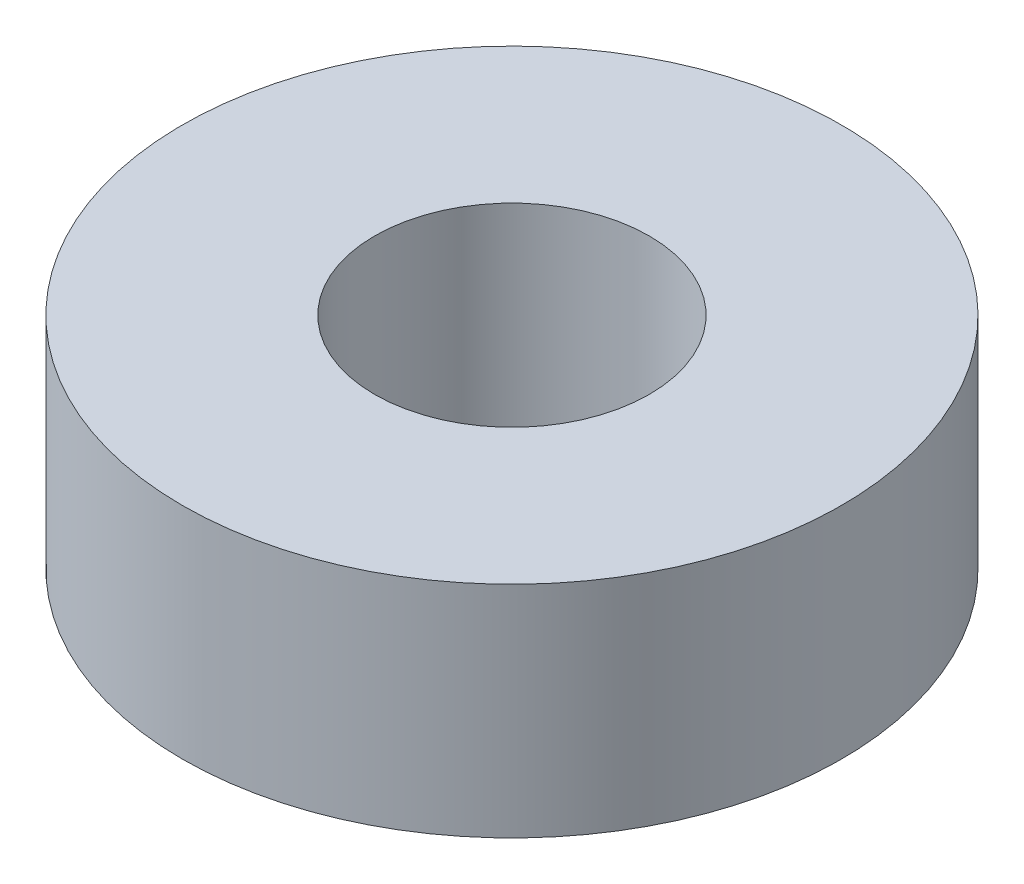
from build123d import *

# Parameters (mm, degrees)
SKETCH_1_R      = 3
SKETCH_1_R_2    = 1.25
EXTRUDE_1_DEPTH = 2


with BuildPart() as part:
    # Эскиз1 → Бобышка-Вытянуть1 (new body)
    with BuildSketch(Plane(origin=(0, 0, 0), x_dir=(1, 0, 0), z_dir=(0, 1, 0))):
        with Locations(Location((0, 0, 0), (0, 0, 270))):
            Circle(SKETCH_1_R)
        with Locations(Location((0, 0, 0), (0, 0, 270))):
            Circle(SKETCH_1_R_2, mode=Mode.SUBTRACT)
    extrude(amount=EXTRUDE_1_DEPTH)


solid = part.part
